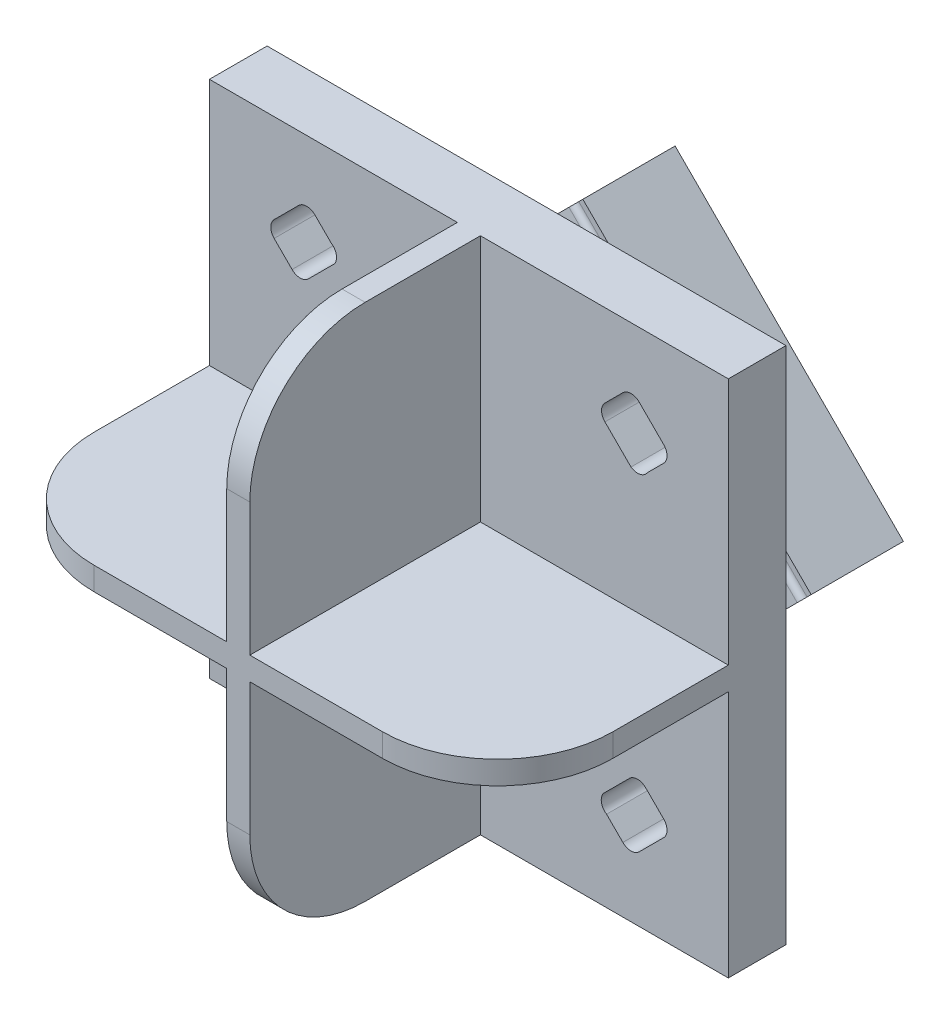
from build123d import *

# Parameters (mm, degrees)
ESQUISSE1_W             = 45
ESQUISSE1_H             = 45
BOSS_EXTRU_1_DEPTH      = 5
BOSS_EXTRU_2_DEPTH      = 20
BOSS_EXTRU_3_DEPTH      = 12
CONG_1_R                = 10
ESQUISSE4_W             = 4
ESQUISSE4_H             = 31.383485478
ENL_V_MAT_EXTRU_1_DEPTH = 1
ESQUISSE6_W             = 4
ESQUISSE6_H             = 28.242544177
ENL_V_MAT_EXTRU_2_DEPTH = 1
CONG_2_R                = 1
CONG_3_R                = 0.5


with BuildPart() as part:
    # Esquisse1 → Boss.-Extru.1 (new body)
    with BuildSketch(Plane.XY):
        Rectangle(ESQUISSE1_W, ESQUISSE1_H)
        with BuildLine():
            Line((14.767944635, 16.889264979), (16.889264979, 14.767944635))
            ThreePointArc((16.889264979, 14.767944635), (17.182158197, 14.060837854), (16.889264979, 13.353731073))
            Line((16.889264979, 13.353731073), (15.475051416, 11.93951751))
            ThreePointArc((15.475051416, 11.93951751), (14.828187526, 11.496881699), (14.060837854, 11.656674798))
            Line((14.060837854, 11.656674798), (11.798096154, 13.919416498))
            ThreePointArc((11.798096154, 13.919416498), (11.505202935, 14.626523279), (11.798096154, 15.33363006))
            Line((11.798096154, 15.33363006), (13.353731073, 16.889264979))
            ThreePointArc((13.353731073, 16.889264979), (14.060837854, 17.182158197), (14.767944635, 16.889264979))
        make_face(mode=Mode.SUBTRACT)
        with BuildLine():
            Line((11.93951751, -15.475051416), (13.353731073, -16.889264979))
            ThreePointArc((13.353731073, -16.889264979), (14.060837854, -17.182158197), (14.767944635, -16.889264979))
            Line((14.767944635, -16.889264979), (16.889264979, -14.767944635))
            ThreePointArc((16.889264979, -14.767944635), (17.182158197, -14.060837854), (16.889264979, -13.353731073))
            Line((16.889264979, -13.353731073), (15.33363006, -11.798096154))
            ThreePointArc((15.33363006, -11.798096154), (14.626523279, -11.505202935), (13.919416498, -11.798096154))
            Line((13.919416498, -11.798096154), (11.656674798, -14.060837854))
            ThreePointArc((11.656674798, -14.060837854), (11.496881699, -14.828187526), (11.93951751, -15.475051416))
        make_face(mode=Mode.SUBTRACT)
        with BuildLine():
            Line((-15.475051416, -11.93951751), (-16.889264979, -13.353731073))
            ThreePointArc((-16.889264979, -13.353731073), (-17.182158197, -14.060837854), (-16.889264979, -14.767944635))
            Line((-16.889264979, -14.767944635), (-14.767944635, -16.889264979))
            ThreePointArc((-14.767944635, -16.889264979), (-14.060837854, -17.182158197), (-13.353731073, -16.889264979))
            Line((-13.353731073, -16.889264979), (-11.798096154, -15.33363006))
            ThreePointArc((-11.798096154, -15.33363006), (-11.505202935, -14.626523279), (-11.798096154, -13.919416498))
            Line((-11.798096154, -13.919416498), (-14.060837854, -11.656674798))
            ThreePointArc((-14.060837854, -11.656674798), (-14.828187526, -11.496881699), (-15.475051416, -11.93951751))
        make_face(mode=Mode.SUBTRACT)
        with BuildLine():
            Line((-11.93951751, 15.475051416), (-13.353731073, 16.889264979))
            ThreePointArc((-13.353731073, 16.889264979), (-14.060837854, 17.182158197), (-14.767944635, 16.889264979))
            Line((-14.767944635, 16.889264979), (-16.889264979, 14.767944635))
            ThreePointArc((-16.889264979, 14.767944635), (-17.182158197, 14.060837854), (-16.889264979, 13.353731073))
            Line((-16.889264979, 13.353731073), (-15.33363006, 11.798096154))
            ThreePointArc((-15.33363006, 11.798096154), (-14.626523279, 11.505202935), (-13.919416498, 11.798096154))
            Line((-13.919416498, 11.798096154), (-11.656674798, 14.060837854))
            ThreePointArc((-11.656674798, 14.060837854), (-11.496881699, 14.828187526), (-11.93951751, 15.475051416))
        make_face(mode=Mode.SUBTRACT)
    extrude(amount=BOSS_EXTRU_1_DEPTH)

    # Esquisse2 → Boss.-Extru.2 (add)
    with BuildSketch(Plane.XY.offset(5)):
        Polygon((-1, 22.5), (-1, 1), (-22.5, 1), (-22.5, -1), (-1, -1), (-1, -22.5), (1, -22.5), (1, -1), (22.5, -1), (22.5, 1), (1, 1), (1, 22.5), align=None)
    extrude(amount=BOSS_EXTRU_2_DEPTH)

    # Esquisse3 → Boss.-Extru.3 (add)
    with BuildSketch(Plane(origin=(0, 0, 0), x_dir=(-1, 0, 0), z_dir=(0, 0, -1))):
        Polygon((-20.68287335, 0.883883476), (-0.883883476, 20.68287335), (20.68287335, -0.883883476), (0.883883476, -20.68287335), align=None)
    extrude(amount=BOSS_EXTRU_3_DEPTH)

    # Congé1
    cong_1_edges = [part.edges().sort_by_distance(p)[0] for p in [
        (0, 22.5, 25),
        (-22.5, 0, 25),
        (0, -22.5, 25),
        (22.5, 0, 25),
    ]]
    fillet(cong_1_edges, radius=CONG_1_R)

    # Esquisse4 → Enlèv. mat.-Extru.1 (cut)
    with BuildSketch(Plane(origin=(10.783378413, 10.783378413, 0), x_dir=(0, 0, -1), z_dir=(0.7071067811865475, 0.7071067811865477, 0))):
        with Locations((2, -1.691742739)):
            Rectangle(ESQUISSE4_W, ESQUISSE4_H)
    extrude(amount=-ENL_V_MAT_EXTRU_1_DEPTH, mode=Mode.SUBTRACT)

    # Esquisse6 → Enlèv. mat.-Extru.2 (cut)
    with BuildSketch(Plane(origin=(-10.783378413, -10.783378413, 0), x_dir=(0, 0, 1), z_dir=(-0.7071067811865476, -0.7071067811865476, 0))):
        with Locations((-2, -0.121272089)):
            Rectangle(ESQUISSE6_W, ESQUISSE6_H)
    extrude(amount=-ENL_V_MAT_EXTRU_2_DEPTH, mode=Mode.SUBTRACT)

    # Congé2
    cong_2_edges = [part.edges().sort_by_distance(p)[0] for p in [
        (9.899494937, -9.899494937, 0),
        (10.076271632, 10.076271632, 0),
        (-9.899494937, 9.899494937, 0),
        (-10.076271632, -10.076271632, 0),
    ]]
    fillet(cong_2_edges, radius=CONG_2_R)

    # Congé3
    cong_3_edges = [part.edges().sort_by_distance(p)[0] for p in [
        (10.076271632, 10.076271632, -4),
        (-10.076271632, -10.076271632, -4),
    ]]
    fillet(cong_3_edges, radius=CONG_3_R)


solid = part.part
